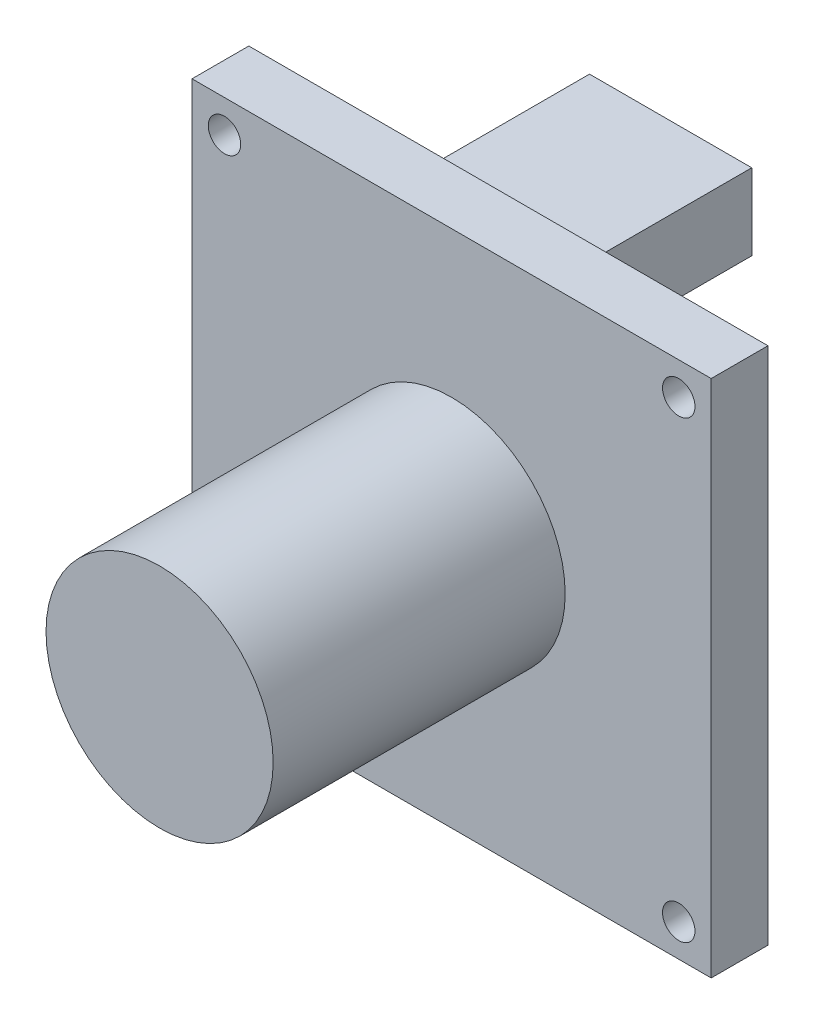
from build123d import *

# Parameters (mm, degrees)
SKETCH1_W           = 32
SKETCH1_H           = 32
BOSS_EXTRUDE1_DEPTH = 3.5
BOSS_EXTRUDE2_START = 3.5
SKETCH2_R           = 7
BOSS_EXTRUDE2_DEPTH = 18
SKETCH3_W           = 10
SKETCH3_H           = 4.7
BOSS_EXTRUDE3_DEPTH = 10
SKETCH4_R           = 1
CUT_EXTRUDE1_DEPTH  = 10


with BuildPart() as part:
    # Sketch1 → Boss-Extrude1 (new body)
    with BuildSketch(Plane.XY):
        Rectangle(SKETCH1_W, SKETCH1_H)
    extrude(amount=BOSS_EXTRUDE1_DEPTH)

    # Sketch2 → Boss-Extrude2 (add)
    with BuildSketch(Plane.XY.offset(BOSS_EXTRUDE2_START)):
        with Locations(Location((0, 0, 0), (0, 0, 180))):
            Circle(SKETCH2_R)
    extrude(amount=BOSS_EXTRUDE2_DEPTH)

    # Sketch3 → Boss-Extrude3 (add)
    with BuildSketch(Plane.XY):
        with Locations((0, 12.65)):
            Rectangle(SKETCH3_W, SKETCH3_H)
    extrude(amount=-BOSS_EXTRUDE3_DEPTH)

    # Sketch4 → Cut-Extrude1 (cut)
    with BuildSketch(Plane.XY):
        with Locations(Location((14, 14, 0), (0, 0, 180))):
            Circle(SKETCH4_R)
        with Locations(Location((-14, 14, 0), (0, 0, 180))):
            Circle(SKETCH4_R)
        with Locations(Location((-14, -14, 0), (0, 0, 180))):
            Circle(SKETCH4_R)
        with Locations(Location((14, -14, 0), (0, 0, 180))):
            Circle(SKETCH4_R)
    extrude(amount=CUT_EXTRUDE1_DEPTH, mode=Mode.SUBTRACT)


solid = part.part
